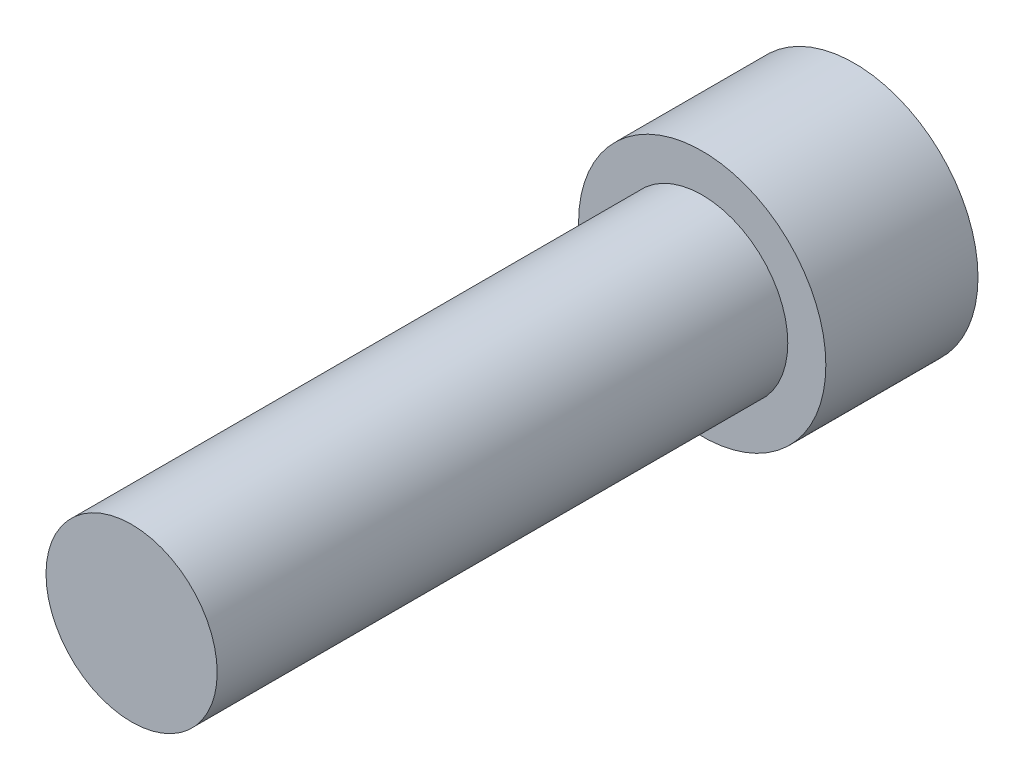
from build123d import *

# Parameters (mm, degrees)
SKETCH_1_R          = 4.5
EXTRUDE_1_DEPTH     = 30
SKETCH_2_R          = 6.5
EXTRUDE_2_DEPTH     = 8
CUT_EXTRUDE_1_DEPTH = 4


with BuildPart() as part:
    # 스케치1 → 보스-돌출1 (new body)
    with BuildSketch(Plane.XY):
        Circle(SKETCH_1_R)
    extrude(amount=EXTRUDE_1_DEPTH)

    # 스케치2 → 보스-돌출2 (add)
    with BuildSketch(Plane(origin=(0, 0, 0), x_dir=(-1, 0, 0), z_dir=(0, 0, -1))):
        Circle(SKETCH_2_R)
    extrude(amount=EXTRUDE_2_DEPTH)

    # 스케치3 → 컷-돌출1 (cut)
    with BuildSketch(Plane(origin=(0, 0, -8), x_dir=(-1, 0, 0), z_dir=(0, 0, -1))):
        with BuildLine():
            Line((1.51655612, -2.298562783), (2.733251781, -0.335660595))
            ThreePointArc((2.733251781, -0.335660595), (2.80802632, -0.087878298), (2.748891822, 0.164094734))
            Line((2.748891822, 0.164094734), (1.657316493, 2.19923518))
            ThreePointArc((1.657316493, 2.19923518), (1.480117999, 2.387882979), (1.232335703, 2.462657518))
            Line((1.232335703, 2.462657518), (-1.075935288, 2.534895775))
            ThreePointArc((-1.075935288, 2.534895775), (-1.327908321, 2.475761277), (-1.51655612, 2.298562783))
            Line((-1.51655612, 2.298562783), (-2.733251781, 0.335660595))
            ThreePointArc((-2.733251781, 0.335660595), (-2.80802632, 0.087878298), (-2.748891822, -0.164094734))
            Line((-2.748891822, -0.164094734), (-1.657316493, -2.19923518))
            ThreePointArc((-1.657316493, -2.19923518), (-1.480117999, -2.387882979), (-1.232335703, -2.462657518))
            Line((-1.232335703, -2.462657518), (1.075935288, -2.534895775))
            ThreePointArc((1.075935288, -2.534895775), (1.327908321, -2.475761277), (1.51655612, -2.298562783))
        make_face()
    extrude(amount=-CUT_EXTRUDE_1_DEPTH, mode=Mode.SUBTRACT)


solid = part.part
